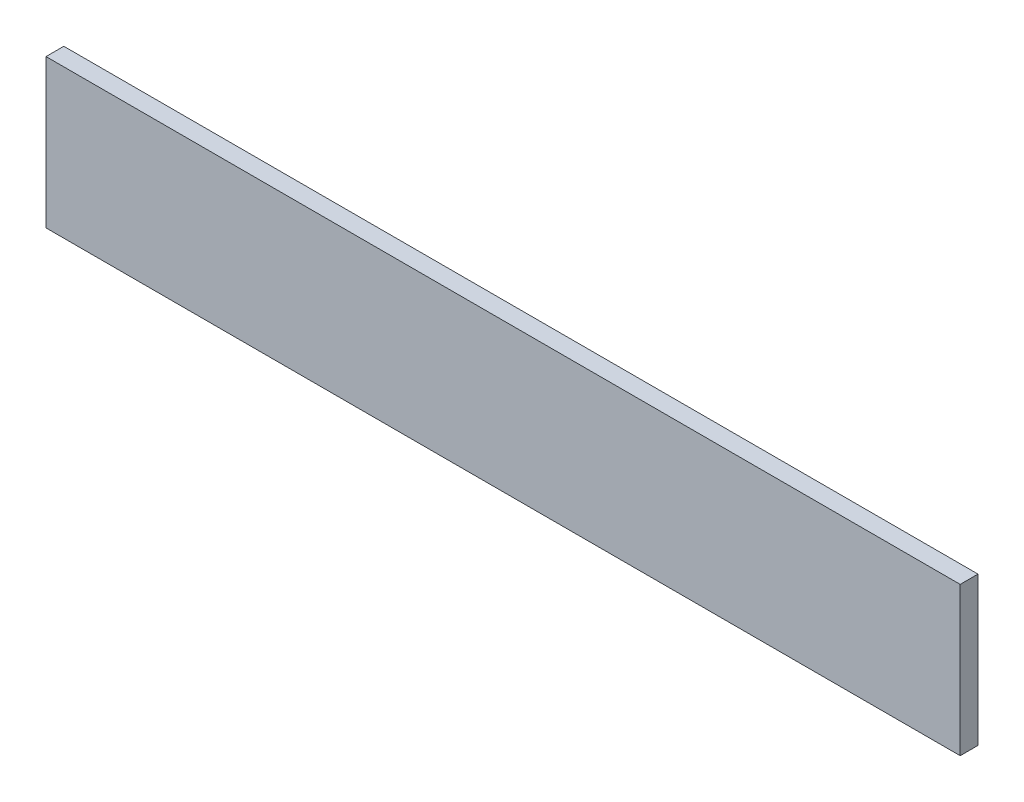
from build123d import *

# Parameters (mm, degrees)
SKETCH1_W     = 154
SKETCH1_H     = 25
PROFILE_DEPTH = 3


with BuildPart() as part:
    # Sketch1 → Profile (new body)
    with BuildSketch(Plane.XY):
        with Locations((77, 12.5)):
            Rectangle(SKETCH1_W, SKETCH1_H)
    extrude(amount=PROFILE_DEPTH)


solid = part.part
